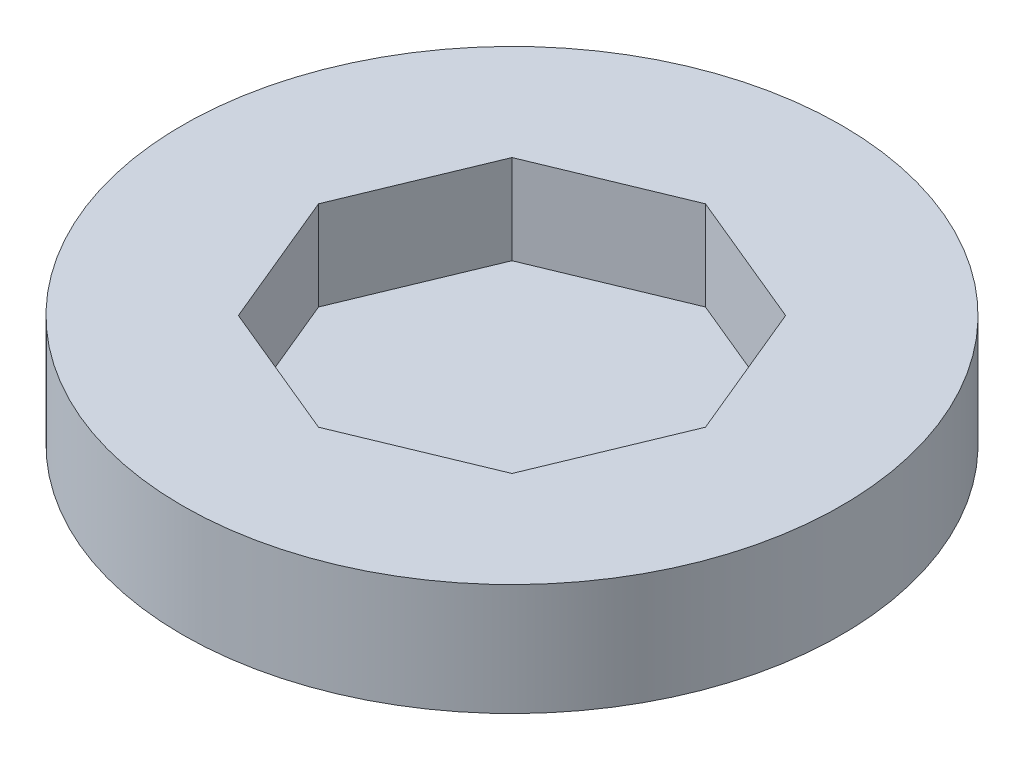
from build123d import *

# Parameters (mm, degrees)
SKETCH1_R           = 29.5
BOSS_EXTRUDE1_DEPTH = 10
CUT_EXTRUDE1_DEPTH  = 8


with BuildPart() as part:
    # Sketch1 → Boss-Extrude1 (new body)
    with BuildSketch(Plane(origin=(0, 0, 0), x_dir=(1, 0, 0), z_dir=(0, 1, 0))):
        with Locations(Location((0, 0, 0), (0, 0, 270))):
            Circle(SKETCH1_R)
    extrude(amount=BOSS_EXTRUDE1_DEPTH)

    # Sketch2 → Cut-Extrude1 (cut)
    with BuildSketch(Plane(origin=(0, 10, 0), x_dir=(1, 0, 0), z_dir=(0, 1, 0))):
        Polygon((12.245869836, 12.245869836), (0, 17.318275205), (-12.245869836, 12.245869836), (-17.318275205, 0), (-12.245869836, -12.245869836), (0, -17.318275205), (12.245869836, -12.245869836), (17.318275205, 0), align=None)
    extrude(amount=-CUT_EXTRUDE1_DEPTH, mode=Mode.SUBTRACT)


solid = part.part
